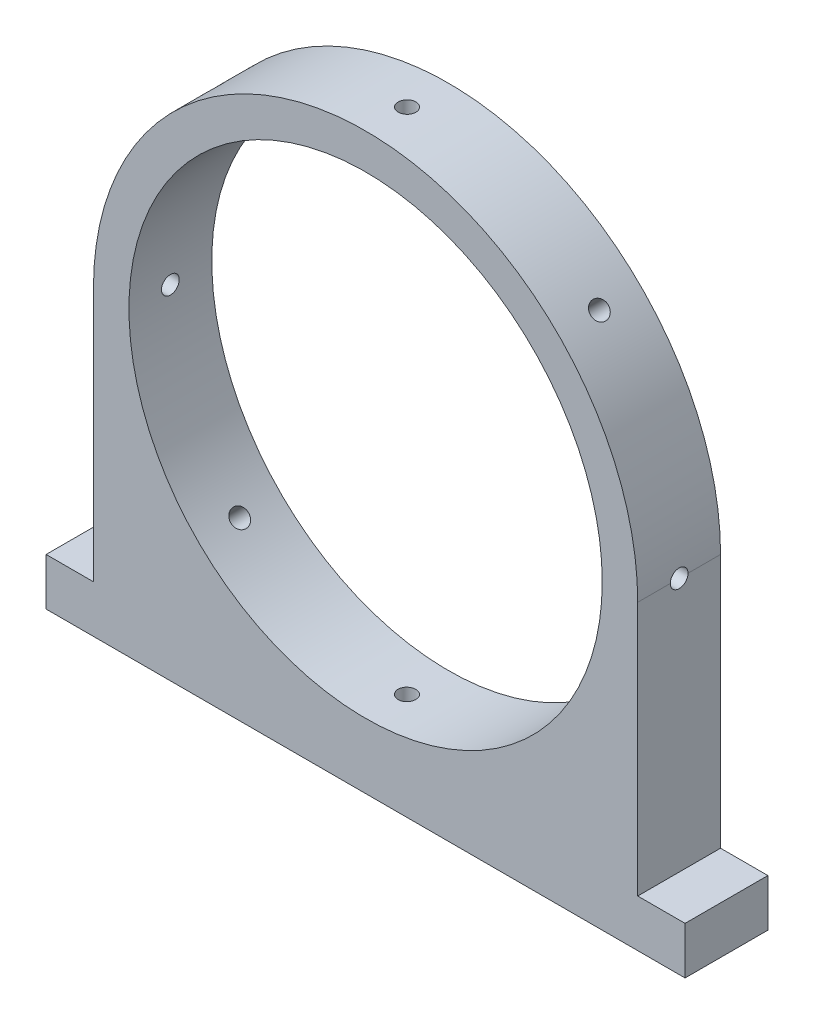
from build123d import *

# Parameters (mm, degrees)
SKETCH1_R           = 40
BOSS_EXTRUDE1_DEPTH = 14
SKETCH2_R           = 1.5
CUT_EXTRUDE1_DEPTH  = 76.584389923
CIRPATTERN1_COUNT   = 8
SKETCH5_W           = 108
SKETCH5_H           = 14
BOSS_EXTRUDE2_DEPTH = 8


with BuildPart() as part:
    # Sketch1 → Boss-Extrude1 (new body)
    with BuildSketch(Plane.XY):
        with BuildLine():
            Line((46, -46), (54, -46))
            Line((54, -46), (54, -51))
            Line((54, -51), (-54, -51))
            Line((-54, -51), (-54, -46))
            Line((-54, -46), (-46, -46))
            Line((-46, -46), (-46, 0))
            ThreePointArc((-46, 0), (0, 46), (46, 0))
            Line((46, 0), (46, -46))
        make_face()
        Circle(SKETCH1_R, mode=Mode.SUBTRACT)
    extrude(amount=BOSS_EXTRUDE1_DEPTH)

    # Sketch2 → Cut-Extrude1 (cut, through all)
    with BuildSketch(Plane(origin=(0, 0, 0), x_dir=(1, 0, 0), z_dir=(0, 1, 0))):
        with Locations(Location((0, -7, 0), (0, 0, 90))):
            Circle(SKETCH2_R)
    cut_extrude1 = extrude(amount=CUT_EXTRUDE1_DEPTH, mode=Mode.SUBTRACT)

    # CirPattern1: Cut-Extrude1 ×8 about axis
    cirpattern1_axis = Axis((0, 0, 0), (0, 0, 1))
    for i in range(1, CIRPATTERN1_COUNT):
        add(cut_extrude1.rotate(cirpattern1_axis, i * 360 / CIRPATTERN1_COUNT), mode=Mode.SUBTRACT)

    # Sketch5 → Boss-Extrude2 (add)
    with BuildSketch(Plane.XZ.offset(51)):
        with Locations((0, 7)):
            Rectangle(SKETCH5_W, SKETCH5_H)
    extrude(amount=-BOSS_EXTRUDE2_DEPTH)


solid = part.part
